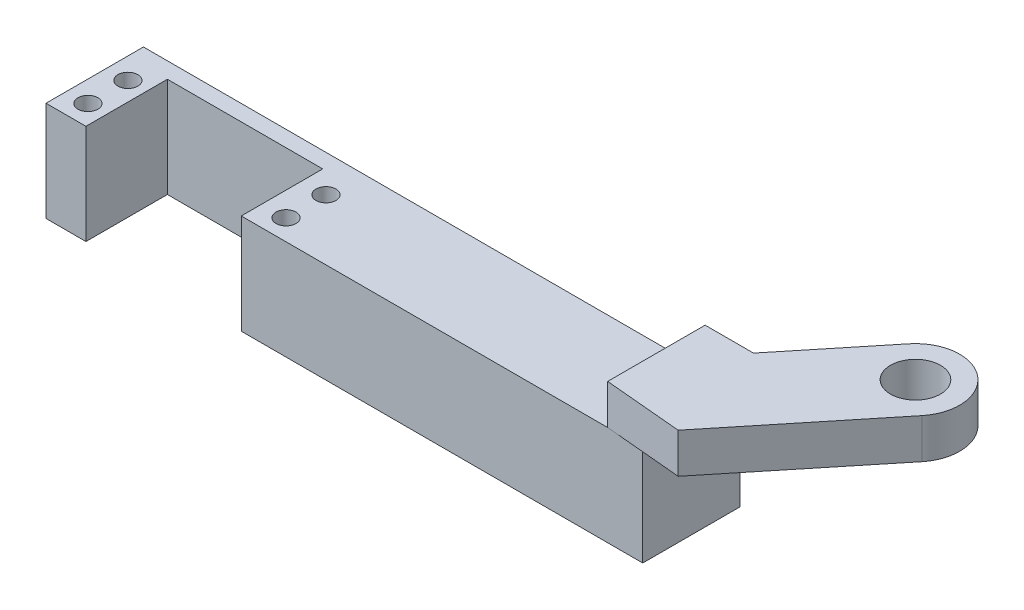
from build123d import *

# Parameters (mm, degrees)
BOSS_EXTRUDE1_DEPTH = 25
SKETCH2_R           = 2.5
CUT_EXTRUDE2_DEPTH  = 10
SKETCH3_R           = 6.260875311
BOSS_EXTRUDE2_DEPTH = 10


with BuildPart() as part:
    # Sketch1 → Boss-Extrude1 (new body)
    with BuildSketch(Plane(origin=(0, 0, 0), x_dir=(1, 0, 0), z_dir=(0, 1, 0))):
        Polygon((0, 0), (-10, 0), (-10, 24.4), (139.433967886, 24.4), (139.433967886, 0), (38.897409925, 0), (38.897409925, 20.4), (0, 20.4), align=None)
    extrude(amount=BOSS_EXTRUDE1_DEPTH)

    # Sketch2 → Cut-Extrude2 (cut)
    with BuildSketch(Plane(origin=(0, 25, 0), x_dir=(1, 0, 0), z_dir=(0, 1, 0))):
        with Locations(Location((-4.7, 15.2, 0), (0, 0, 270))):
            Circle(SKETCH2_R)
        with Locations(Location((-4.7, 5.2, 0), (0, 0, 270))):
            Circle(SKETCH2_R)
        with Locations(Location((44.9, 5.2, 0), (0, 0, 90))):
            Circle(SKETCH2_R)
        with Locations(Location((44.9, 15.2, 0), (0, 0, 90))):
            Circle(SKETCH2_R)
    extrude(amount=-CUT_EXTRUDE2_DEPTH, mode=Mode.SUBTRACT)

    # Sketch3 → Boss-Extrude2 (add)
    with BuildSketch(Plane(origin=(0, 25, 0), x_dir=(1, 0, 0), z_dir=(0, 1, 0))):
        with BuildLine():
            Line((130.655933967, 24.4), (142.775772415, 24.4))
            Line((142.775772415, 24.4), (160.225946606, 45.887947938))
            ThreePointArc((160.225946606, 45.887947938), (175.801056072, 47.503042983), (177.416151117, 31.927933517))
            Line((177.416151117, 31.927933517), (150.060915274, -1.756995769))
            Line((150.060915274, -1.756995769), (130.655933967, 0))
            Line((130.655933967, 0), (130.655933967, 24.4))
        make_face()
        with Locations(Location((168.821048861, 38.907940727, 0), (0, 0, 270))):
            Circle(SKETCH3_R, mode=Mode.SUBTRACT)
    extrude(amount=BOSS_EXTRUDE2_DEPTH)


solid = part.part
